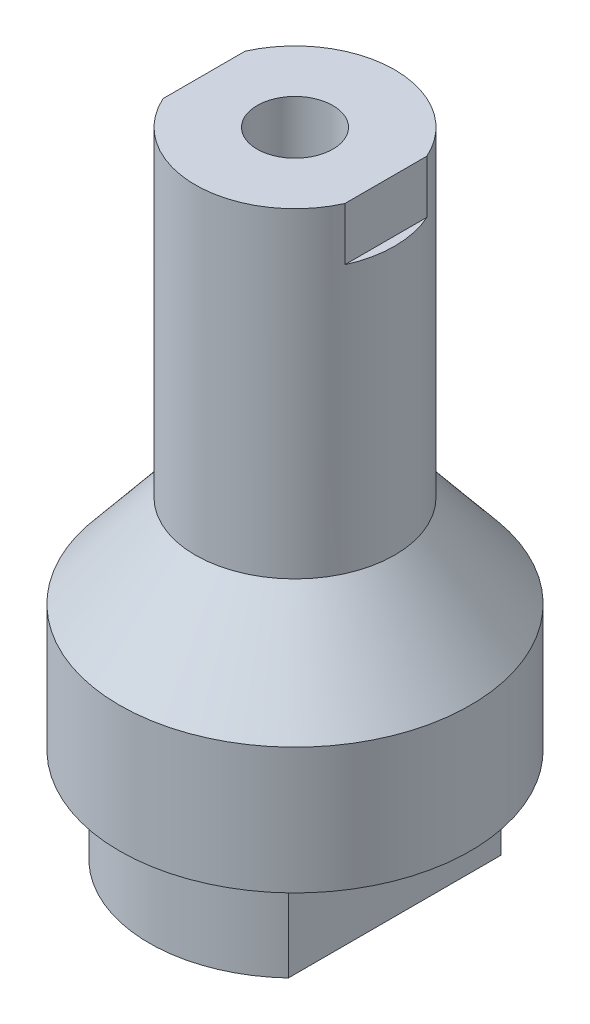
from build123d import *

# Parameters (mm, degrees)
CORTE_EXTRUS_O1_DEPTH      = 27.95579715
CORTE_EXTRUS_O1_DEPTH_BACK = 27.95579715
ESBO_O2_W                  = 1.825
ESBO_O2_H                  = 3.75
ESBO_O2_W_2                = 0.35
ESBO_O2_H_2                = 2.1
CORTE_EXTRUS_O2_DEPTH      = 27.95579715
CORTE_EXTRUS_O2_DEPTH_BACK = 27.95579715
ESBO_O3_R                  = 1.5


with BuildPart() as part:
    # Esboço1 → Revolução1 (revolve)
    with BuildSketch(Plane.XY, mode=Mode.PRIVATE) as revolu_o1_sk:
        Polygon((-5.775, 0), (-5.775, 3.75), (-6.95, 3.75), (-6.95, 8.75), (-3.95, 12.4), (-3.95, 25.1), (0, 25.1), (0, 0), align=None)
    revolve(revolu_o1_sk.sketch.rotate(Axis((0, 0, 0), (0, 1, 0)), 270), axis=Axis((0, 0, 0), (0, 1, 0)))

    # Esboço2 → Corte-extrusão1 (cut, two sides: drawn at the far end of the back side and taken through both)
    with BuildSketch(Plane.XY.offset(-CORTE_EXTRUS_O1_DEPTH_BACK)):
        with Locations((-4.8625, 1.875)):
            Rectangle(ESBO_O2_W, ESBO_O2_H)
        with Locations((-3.775, 24.05)):
            Rectangle(ESBO_O2_W_2, ESBO_O2_H_2)
        with Locations((3.775, 24.05)):
            Rectangle(ESBO_O2_W_2, ESBO_O2_H_2)
        with Locations((4.8625, 1.875)):
            Rectangle(ESBO_O2_W, ESBO_O2_H)
    extrude(amount=CORTE_EXTRUS_O1_DEPTH + CORTE_EXTRUS_O1_DEPTH_BACK, mode=Mode.SUBTRACT)

    # Esboço3 → Corte-extrusão2 (cut, two sides: drawn at the far end of the back side and taken through both)
    with BuildSketch(Plane(origin=(0, 0, 0), x_dir=(1, 0, 0), z_dir=(0, 1, 0)).offset(-CORTE_EXTRUS_O2_DEPTH_BACK)):
        with Locations(Location((0, 0, 0), (0, 0, 270))):
            Circle(ESBO_O3_R)
    extrude(amount=CORTE_EXTRUS_O2_DEPTH + CORTE_EXTRUS_O2_DEPTH_BACK, mode=Mode.SUBTRACT)


solid = part.part
